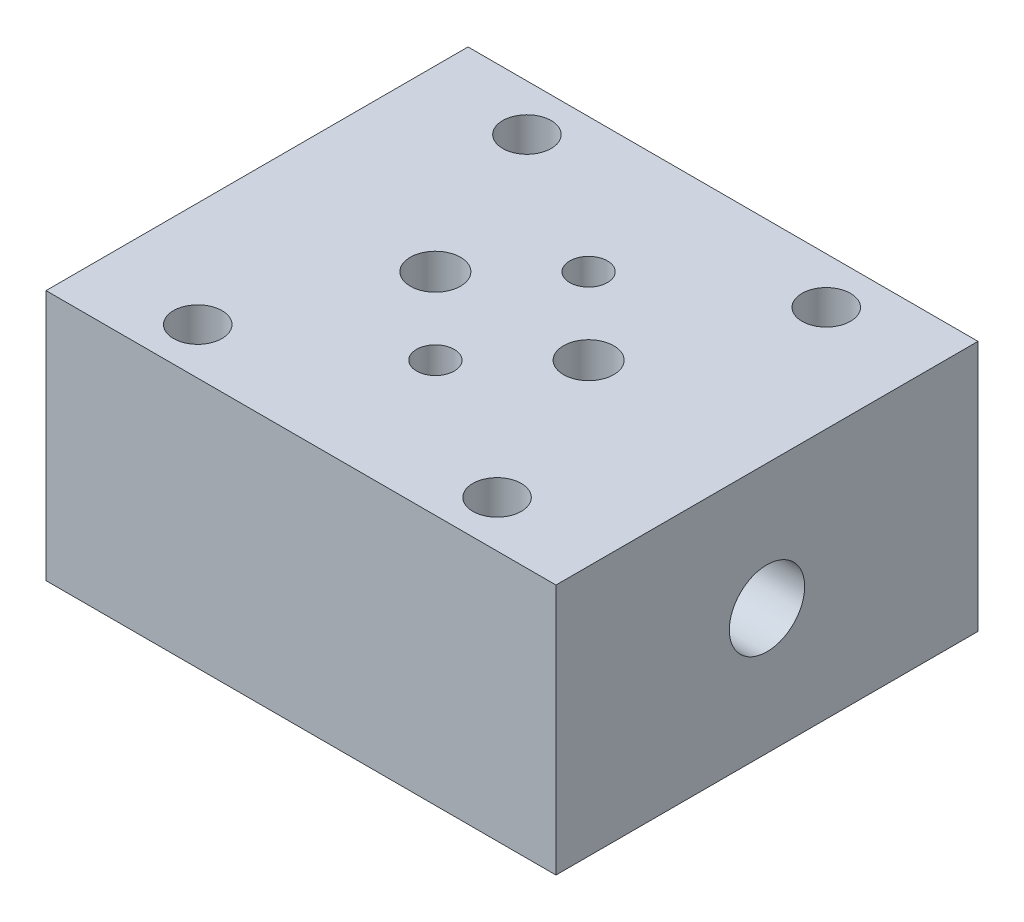
from build123d import *

# Parameters (mm, degrees)
SKETCH1_W       = 40.6
SKETCH1_H       = 33.6
EXTRUDE6_DEPTH  = 20
SKETCH7_R       = 1.93
EXTRUDE12_DEPTH = 46.510692117
SKETCH12_R      = 2
SKETCH12_R_2    = 1.5
EXTRUDE13_DEPTH = 15
SKETCH13_R      = 3
EXTRUDE14_DEPTH = 14.2


with BuildPart() as part:
    # Sketch1 → Extrude6 (new body)
    with BuildSketch(Plane(origin=(0, 0, 0), x_dir=(1, 0, 0), z_dir=(0, 1, 0))):
        with Locations((13.300799804, -6.485389185)):
            Rectangle(SKETCH1_W, SKETCH1_H)
    extrude(amount=EXTRUDE6_DEPTH)

    # Sketch7 → Extrude12 (cut, through all)
    with BuildSketch(Plane(origin=(0, 20, 0), x_dir=(-1, 0, 0), z_dir=(0, 1, 0))):
        with Locations(Location((-1.385799804, -6.619610815, 0), (0, 0, 90))):
            Circle(SKETCH7_R)
        with Locations(Location((-25.215799804, -6.619610815, 0), (0, 0, 90))):
            Circle(SKETCH7_R)
        with Locations(Location((-1.385799804, 19.590389185, 0), (0, 0, 90))):
            Circle(SKETCH7_R)
        with Locations(Location((-25.215799804, 19.590389185, 0), (0, 0, 90))):
            Circle(SKETCH7_R)
    extrude(amount=-EXTRUDE12_DEPTH, mode=Mode.SUBTRACT)

    # Sketch12 → Extrude13 (cut)
    with BuildSketch(Plane(origin=(0, 20, 0), x_dir=(1, 0, 0), z_dir=(0, 1, 0))):
        with Locations(Location((7.200799804, -6.485389185, 0), (0, 0, 270))):
            Circle(SKETCH12_R)
        with Locations(Location((13.300799804, -0.385389185, 0), (0, 0, 270))):
            Circle(SKETCH12_R_2)
        with Locations(Location((19.400799804, -6.485389185, 0), (0, 0, 270))):
            Circle(SKETCH12_R)
        with Locations(Location((13.300799804, -12.585389185, 0), (0, 0, 270))):
            Circle(SKETCH12_R_2)
    extrude(amount=-EXTRUDE13_DEPTH, mode=Mode.SUBTRACT)

    # Sketch13 → Extrude14 (cut)
    with BuildSketch(Plane(origin=(33.600799804, 0, 0), x_dir=(0, 0, -1), z_dir=(1, 0, 0))):
        with Locations((-6.485389185, 10)):
            Circle(SKETCH13_R)
    extrude(amount=-EXTRUDE14_DEPTH, mode=Mode.SUBTRACT)


solid = part.part
